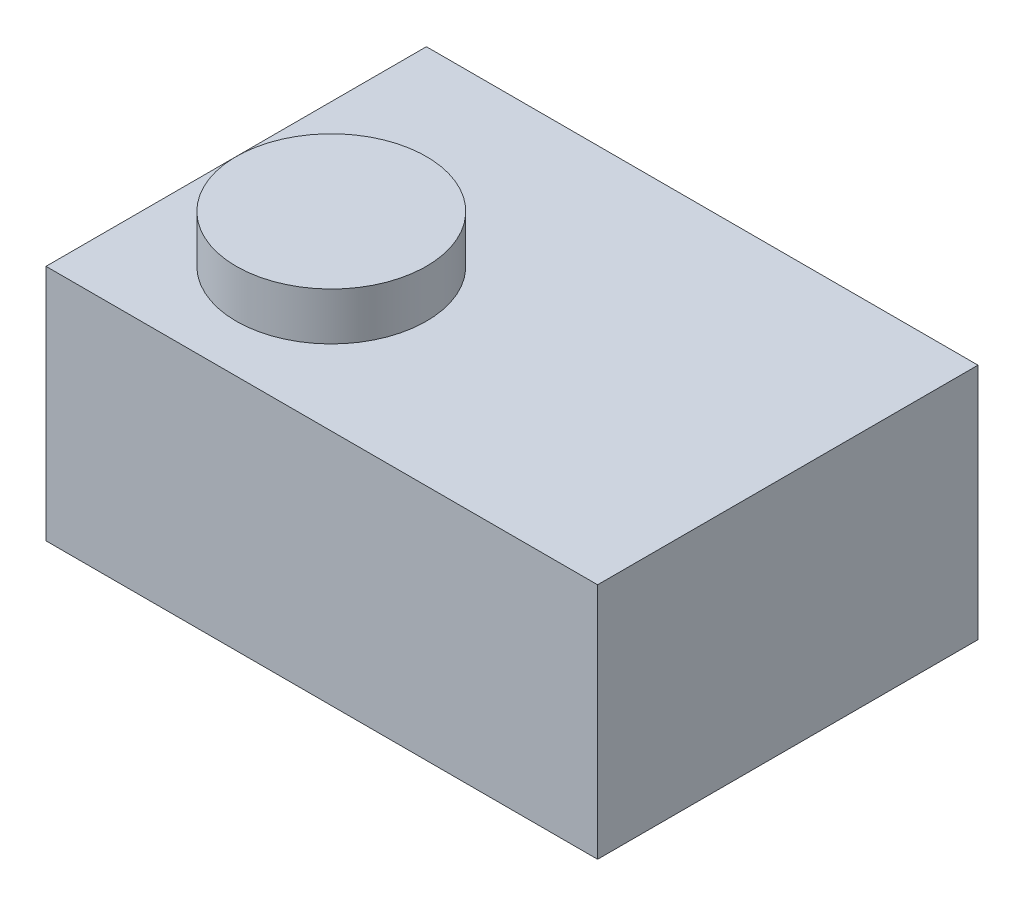
from build123d import *

# Parameters (mm, degrees)
SKETCH1_W           = 58
SKETCH1_H           = 40
BOSS_EXTRUDE1_DEPTH = 25
SKETCH2_R           = 10
BOSS_EXTRUDE2_DEPTH = 5


with BuildPart() as part:
    # Sketch1 → Boss-Extrude1 (new body)
    with BuildSketch(Plane(origin=(0, 0, 0), x_dir=(1, 0, 0), z_dir=(0, 1, 0))):
        with Locations((1.173410405, 0.578034682)):
            Rectangle(SKETCH1_W, SKETCH1_H)
    extrude(amount=BOSS_EXTRUDE1_DEPTH)

    # Sketch2 → Boss-Extrude2 (add)
    with BuildSketch(Plane(origin=(0, 25, 0), x_dir=(1, 0, 0), z_dir=(0, 1, 0))):
        with Locations(Location((-12.826589595, -4.421965318, 0), (0, 0, 270))):
            Circle(SKETCH2_R)
    extrude(amount=BOSS_EXTRUDE2_DEPTH)


solid = part.part
